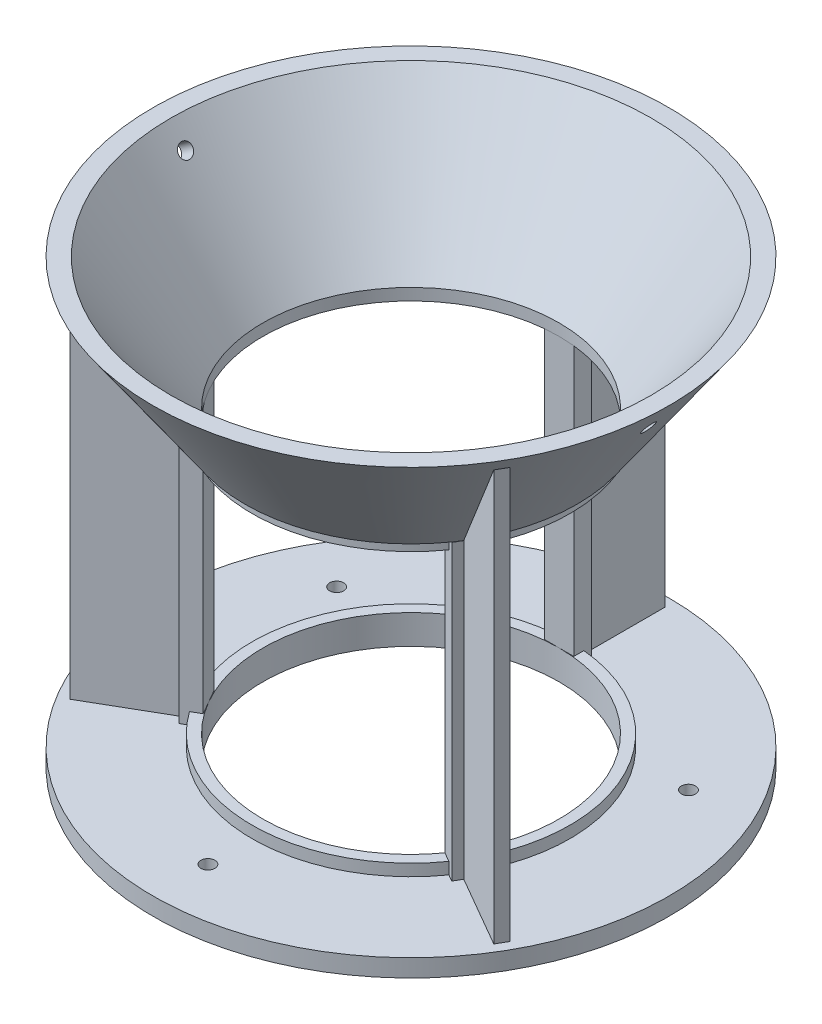
from build123d import *

# Parameters (mm, degrees)
SKETCH36_R          = 0.6
SIDE_HOLES_DEPTH    = 2
CIRPATTERN2_COUNT   = 2
SKETCH38_W          = 1.525968236
SKETCH38_H          = 25
BOSS_EXTRUDE5_DEPTH = 1.25
BOSS_EXTRUDE6_DEPTH = 0.5
CIRPATTERN3_COUNT   = 3
SKETCH39_R          = 22
SKETCH39_R_2        = 12.63
BOSS_EXTRUDE7_DEPTH = 1.5
SKETCH40_R          = 0.6
CUT_EXTRUDE1_DEPTH  = 48.734856834
CIRPATTERN4_COUNT   = 3
BOSS_EXTRUDE8_START = 1
SKETCH41_R          = 13.545580942
SKETCH41_R_2        = 12.63
BOSS_EXTRUDE8_DEPTH = 1
SKETCH42_R          = 13.545580942
SKETCH42_R_2        = 12.63
BOSS_EXTRUDE9_DEPTH = 1


with BuildPart() as part:
    # Sketch35 → Revolve1 (revolve)
    with BuildSketch(Plane.XY, mode=Mode.PRIVATE) as revolve1_sk:
        Polygon((20.474031764, 11.202438329), (12.63, 0), (14.155968236, 0), (22, 11.202438329), align=None)
    revolve(revolve1_sk.sketch.rotate(Axis((0, 11.202438329, 0), (0, -1, 0)), 90), axis=Axis((0, 11.202438329, 0), (0, -1, 0)))

    # Sketch36 → side-holes (cut, symmetric)
    with BuildSketch(Plane(origin=(8.474857205, -5.9341589, 0), x_dir=(0, 0, 1), z_dir=(-0.8191520442889934, 0.5735764363510439, 0))):
        with Locations(Location((0, 18.744270391, 0), (0, 0, 239.229798776))):
            Circle(SKETCH36_R)
    side_holes = extrude(amount=SIDE_HOLES_DEPTH, both=True, mode=Mode.SUBTRACT)

    # CirPattern2: side-holes ×2 about axis
    cirpattern2_axis = Axis((0, 0, 0), (0, 1, 0))
    for i in range(1, CIRPATTERN2_COUNT):
        add(side_holes.rotate(cirpattern2_axis, i * 360 / CIRPATTERN2_COUNT), mode=Mode.SUBTRACT)

    # Sketch38 → Boss-Extrude5 (add, symmetric)
    with BuildSketch(Plane(origin=(0, 0, 0), x_dir=(0, 0, -1), z_dir=(1, 0, 0))):
        with Locations((13.392984118, -12.5)):
            Rectangle(SKETCH38_W, SKETCH38_H)
    boss_extrude5 = extrude(amount=BOSS_EXTRUDE5_DEPTH, both=True)

    # Sketch38<6> → Boss-Extrude6 (add, symmetric)
    with BuildSketch(Plane(origin=(0, 0, 0), x_dir=(0, 0, -1), z_dir=(1, 0, 0))):
        Polygon((19.63, 9.997036047), (12.63, 0), (14.155968236, 0), (14.155968236, -25), (21.155968236, -25), (21.155968236, 9.997036047), align=None)
    boss_extrude6 = extrude(amount=BOSS_EXTRUDE6_DEPTH, both=True)

    # CirPattern3: Boss-Extrude5, Boss-Extrude6 ×3 about axis
    cirpattern3_axis = Axis((0, 0, 0), (0, 1, 0))
    add([boss_extrude5.rotate(cirpattern3_axis, i * 360 / CIRPATTERN3_COUNT) for i in range(1, CIRPATTERN3_COUNT)])
    add([boss_extrude6.rotate(cirpattern3_axis, i * 360 / CIRPATTERN3_COUNT) for i in range(1, CIRPATTERN3_COUNT)])

    # Sketch39 → Boss-Extrude7 (add)
    with BuildSketch(Plane.XZ.offset(25)):
        with Locations(Location((0, 0, 0), (0, 0, 270))):
            Circle(SKETCH39_R)
        with Locations(Location((0, 0, 0), (0, 0, 270))):
            Circle(SKETCH39_R_2, mode=Mode.SUBTRACT)
    extrude(amount=BOSS_EXTRUDE7_DEPTH)

    # Sketch40 → Cut-Extrude1 (cut, through all)
    with BuildSketch(Plane(origin=(0, -25, 0), x_dir=(1, 0, 0), z_dir=(0, 1, 0))):
        with Locations(Location((0, -17.315, 0), (0, 0, 270))):
            Circle(SKETCH40_R)
    cut_extrude1 = extrude(amount=-CUT_EXTRUDE1_DEPTH, mode=Mode.SUBTRACT)

    # CirPattern4: Cut-Extrude1 ×3 about axis
    cirpattern4_axis = Axis((0, 0, 0), (0, 1, 0))
    for i in range(1, CIRPATTERN4_COUNT):
        add(cut_extrude1.rotate(cirpattern4_axis, i * 360 / CIRPATTERN4_COUNT), mode=Mode.SUBTRACT)

    # Sketch41 → Boss-Extrude8 (add)
    with BuildSketch(Plane(origin=(0, -25, 0), x_dir=(1, 0, 0), z_dir=(0, 1, 0)).offset(BOSS_EXTRUDE8_START)):
        Circle(SKETCH41_R)
        with Locations(Location((0, 0, 0), (0, 0, 90))):
            Circle(SKETCH41_R_2, mode=Mode.SUBTRACT)
    extrude(amount=-BOSS_EXTRUDE8_DEPTH)

    # Sketch42 → Boss-Extrude9 (add)
    with BuildSketch(Plane.XZ):
        Circle(SKETCH42_R)
        with Locations(Location((0, 0, 0), (0, 0, 270))):
            Circle(SKETCH42_R_2, mode=Mode.SUBTRACT)
    extrude(amount=BOSS_EXTRUDE9_DEPTH)


solid = part.part
